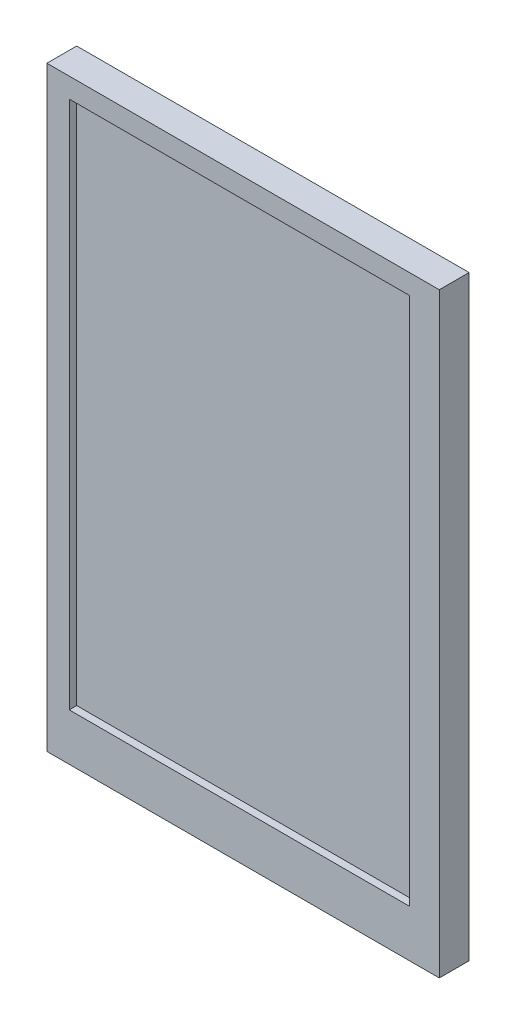
from build123d import *

# Parameters (mm, degrees)
SKETCH2_W           = 240
SKETCH2_H           = 158
BOSS_EXTRUDE1_DEPTH = 12
SKETCH4_W           = 137
SKETCH4_H           = 213
CUT_EXTRUDE1_DEPTH  = 3


with BuildPart() as part:
    # Sketch2 → Boss-Extrude1 (new body)
    with BuildSketch(Plane(origin=(0, 0, 0), x_dir=(0, 1, 0), z_dir=(0, 0, 1))):
        Rectangle(SKETCH2_W, SKETCH2_H)
    extrude(amount=BOSS_EXTRUDE1_DEPTH)

    # Sketch4 → Cut-Extrude1 (cut)
    with BuildSketch(Plane.XY.offset(12)):
        with Locations((-1.5, 5.5)):
            Rectangle(SKETCH4_W, SKETCH4_H)
    extrude(amount=-CUT_EXTRUDE1_DEPTH, mode=Mode.SUBTRACT)


solid = part.part
